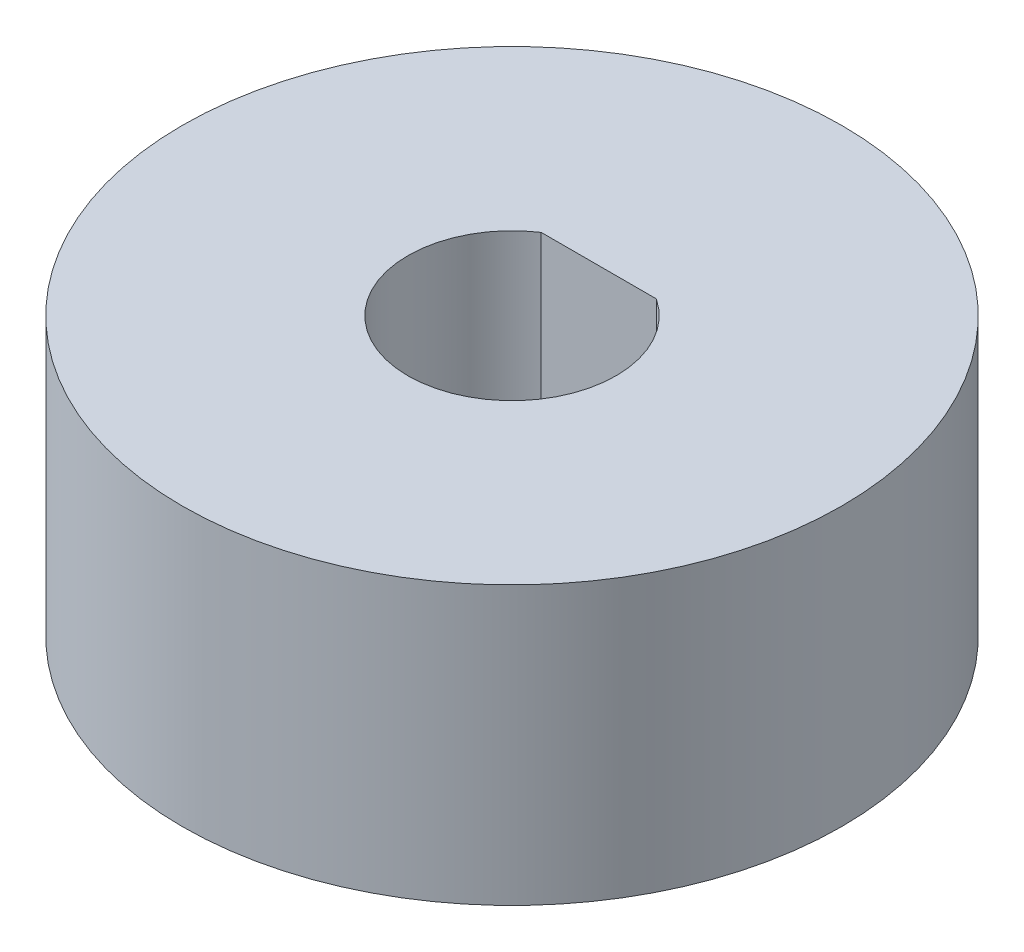
from build123d import *

# Parameters (mm, degrees)
SKETCH_1_W      = 6.5
SKETCH_1_H      = 8
EXTRUDE_1_DEPTH = 8


with BuildPart() as part:
    # 草图1 → 旋转1 (revolve)
    with BuildSketch(Plane.XY, mode=Mode.PRIVATE) as revolve_1_sk:
        with Locations((-6.25, 4)):
            Rectangle(SKETCH_1_W, SKETCH_1_H)
    revolve(revolve_1_sk.sketch.rotate(Axis((0, 0, 0), (0, 1, 0)), 270), axis=Axis((0, 0, 0), (0, 1, 0)))

    # 草图2 → 凸台-拉伸1 (add)
    with BuildSketch(Plane.XZ):
        with BuildLine():
            Line((1.658312395, -2.5), (-1.658312395, -2.5))
            ThreePointArc((-1.658312395, -2.5), (0, -3), (1.658312395, -2.5))
        make_face()
    extrude(amount=-EXTRUDE_1_DEPTH)


solid = part.part
